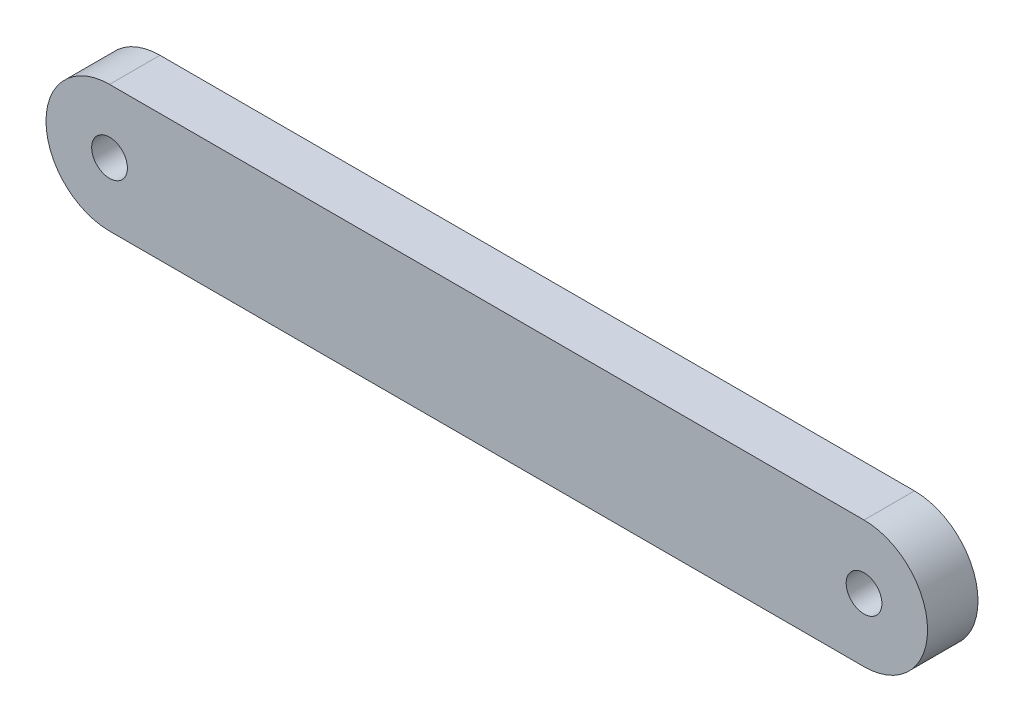
from build123d import *

# Parameters (mm, degrees)
SKETCH2_R           = 2.25
BOSS_EXTRUDE1_DEPTH = 6.35


with BuildPart() as part:
    # Sketch2 → Boss-Extrude1 (new body)
    with BuildSketch(Plane(origin=(0, 0, 83.955), x_dir=(-1, 0, 0), z_dir=(0, 0, -1))):
        with BuildLine():
            Line((-47.5, 8), (47.5, 8))
            ThreePointArc((47.5, 8), (55.5, 0), (47.5, -8))
            Line((47.5, -8), (-47.5, -8))
            ThreePointArc((-47.5, -8), (-55.5, 0), (-47.5, 8))
        make_face()
        with Locations((-47.5, 0)):
            Circle(SKETCH2_R, mode=Mode.SUBTRACT)
        with Locations((47.5, 0)):
            Circle(SKETCH2_R, mode=Mode.SUBTRACT)
    extrude(amount=BOSS_EXTRUDE1_DEPTH)


solid = part.part
